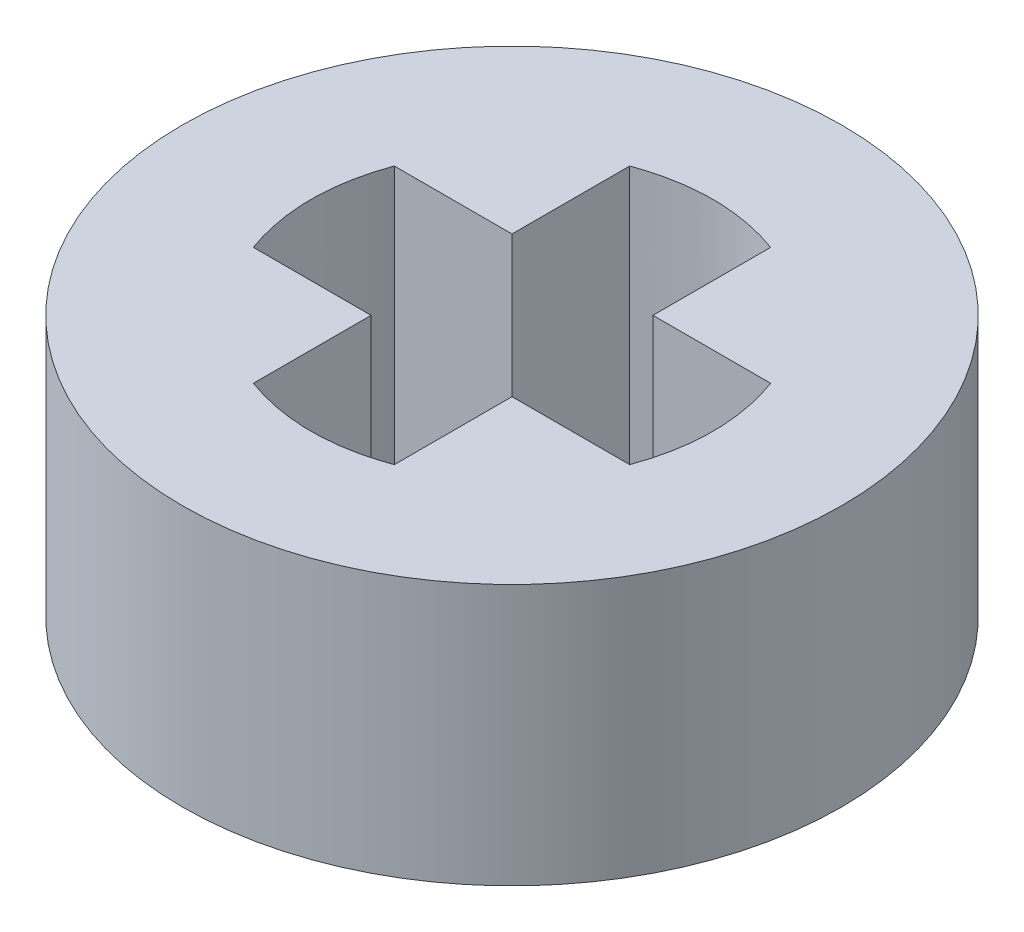
from build123d import *

# Parameters (mm, degrees)
SKETCH1_R           = 3.79
BOSS_EXTRUDE1_DEPTH = 3
CUT_EXTRUDE1_DEPTH  = 3


with BuildPart() as part:
    # Sketch1 → Boss-Extrude1 (new body)
    with BuildSketch(Plane(origin=(0, 0, 0), x_dir=(1, 0, 0), z_dir=(0, 1, 0))):
        with Locations(Location((0, 0, 0), (0, 0, 270))):
            Circle(SKETCH1_R)
    extrude(amount=BOSS_EXTRUDE1_DEPTH)

    # Sketch2 → Cut-Extrude1 (cut)
    with BuildSketch(Plane(origin=(0, 3, 0), x_dir=(1, 0, 0), z_dir=(0, 1, 0))):
        with BuildLine():
            Line((-2.163330765, 0.81), (-0.81, 0.81))
            Line((-0.81, 0.81), (-0.81, 2.163330765))
            add(Edge.make_bspline(
                [(-0.81, 2.163330765), (0, 2.456669235), (0.81, 2.163330765)],
                knots=[0, 0, 0, 1, 1, 1], degree=2))
            Line((0.81, 2.163330765), (0.81, 0.81))
            Line((0.81, 0.81), (2.163330765, 0.81))
            add(Edge.make_bspline(
                [(2.163330765, 0.81), (2.456669235, 0), (2.163330765, -0.81)],
                knots=[0, 0, 0, 1, 1, 1], degree=2))
            Line((2.163330765, -0.81), (0.81, -0.81))
            Line((0.81, -0.81), (0.81, -2.163330765))
            add(Edge.make_bspline(
                [(0.81, -2.163330765), (0, -2.456669235), (-0.81, -2.163330765)],
                knots=[0, 0, 0, 1, 1, 1], degree=2))
            Line((-0.81, -2.163330765), (-0.81, -0.81))
            Line((-0.81, -0.81), (-2.163330765, -0.81))
            add(Edge.make_bspline(
                [(-2.163330765, -0.81), (-2.456669235, 0), (-2.163330765, 0.81)],
                knots=[0, 0, 0, 1, 1, 1], degree=2))
        make_face()
    extrude(amount=-CUT_EXTRUDE1_DEPTH, mode=Mode.SUBTRACT)


solid = part.part
